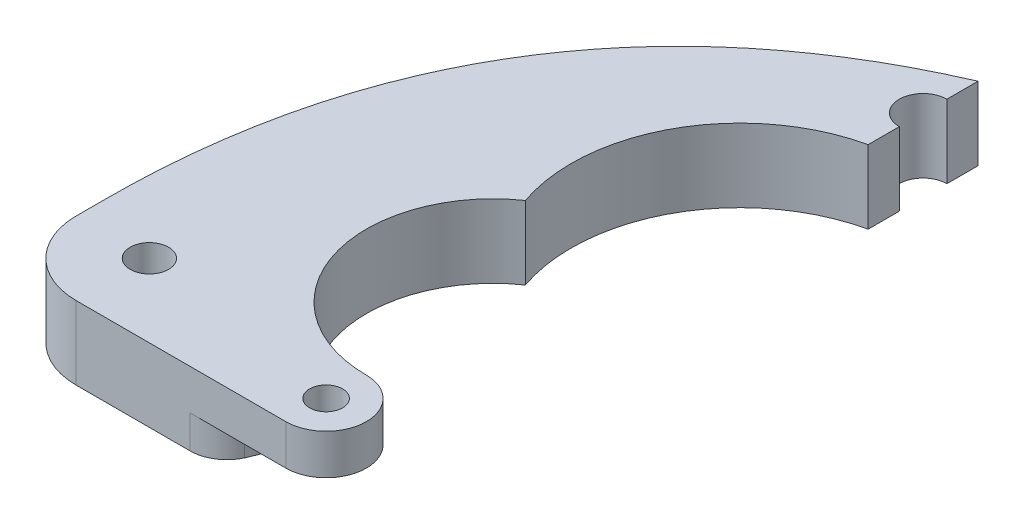
from build123d import *

# Parameters (mm, degrees)
SKETCH1_R           = 0.9
SKETCH1_R_2         = 1.05
BOSS_EXTRUDE2_DEPTH = 4
CUT_EXTRUDE1_DEPTH  = 1.8
FILLET3_R           = 2


with BuildPart() as part:
    # Sketch1 → Boss-Extrude2 (new body)
    with BuildSketch(Plane(origin=(0, 0, 0), x_dir=(1, 0, 0), z_dir=(0, 1, 0))):
        with BuildLine():
            Line((0, 51.3), (0, 53))
            add(Edge.make_bspline(
                [(0, 53), (-11.288586004, 48.107069446), (-18.25, 38.69126661), (-18.25, 23.6)],
                knots=[0, 0, 0, 0, 1, 1, 1, 1], degree=3))
            Line((-18.25, 23.6), (-18.25, 22))
            ThreePointArc((-18.25, 22), (-17.078427125, 19.171572875), (-14.25, 18))
            Line((-14.25, 18), (-2.8, 18))
            ThreePointArc((-2.8, 18), (-0.6, 20.2), (-2.8, 22.4))
            ThreePointArc((-2.8, 22.4), (-9.397521131, 27.257683793), (-6.717797887, 35))
            ThreePointArc((-6.717797887, 35), (-6.044737279, 42.503576591), (0, 47))
            Line((0, 47), (0, 48.7))
            ThreePointArc((0, 48.7), (-1.3, 50), (0, 51.3))
        make_face()
        with Locations(Location((-2.8, 20.2, 0), (0, 0, 270))):
            Circle(SKETCH1_R, mode=Mode.SUBTRACT)
        with Locations(Location((-14.25, 22, 0), (0, 0, 270))):
            Circle(SKETCH1_R_2, mode=Mode.SUBTRACT)
    extrude(amount=BOSS_EXTRUDE2_DEPTH)

    # Sketch2 → Cut-Extrude1 (cut)
    with BuildSketch(Plane.XZ):
        with BuildLine():
            Line((-6.923832439, -18), (-2.8, -18))
            ThreePointArc((-2.8, -18), (-0.6, -20.2), (-2.8, -22.4))
            ThreePointArc((-2.8, -22.4), (-4.33863899, -22.573504229), (-5.8, -23.085302684))
            ThreePointArc((-5.8, -23.085302684), (-5.781399577, -20.414359385), (-6.923832439, -18))
        make_face()
    extrude(amount=-CUT_EXTRUDE1_DEPTH, mode=Mode.SUBTRACT)

    # Fillet3
    fillet3_edges = [part.edges().sort_by_distance(p)[0] for p in [
        (-5.8, 0.9, -23.085302684),
        (-6.923832439, 0.9, -18),
    ]]
    fillet(fillet3_edges, radius=FILLET3_R)


solid = part.part
